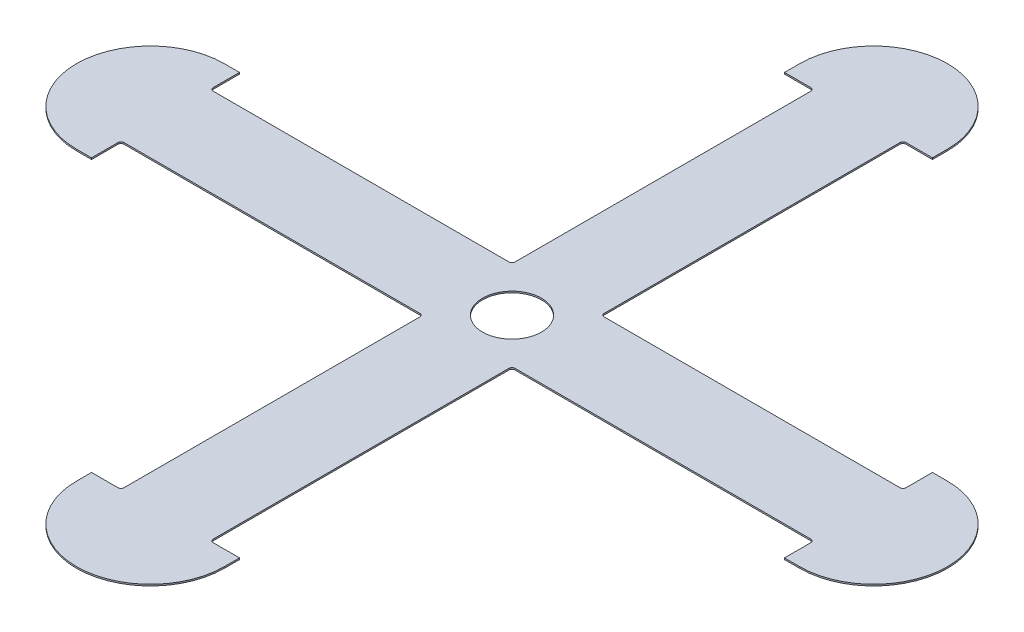
from build123d import *

# Parameters (mm, degrees)
SKETCH1_W           = 22.95
SKETCH1_H           = 22.95
SKETCH1_W_2         = 22.45
SKETCH1_H_2         = 22.45
SKETCH1_W_3         = 0.25
SKETCH1_H_3         = 9.5
SKETCH1_W_4         = 9.5
SKETCH1_H_4         = 0.25
SKETCH1_R           = 0.975
SKETCH1_H_5         = 1
SKETCH1_W_5         = 1
BOSS_EXTRUDE5_DEPTH = 0.05
CUT_EXTRUDE1_DEPTH  = 17.93528122
SKETCH4_W           = 0.75
SKETCH4_H           = 2.95
SKETCH4_W_2         = 9.5
SKETCH4_W_3         = 2.95
SKETCH4_H_2         = 9.5
SKETCH4_H_3         = 0.75
BOSS_EXTRUDE9_DEPTH = 0.05


with BuildPart() as part:
    # Sketch1 → Boss-Extrude5 (new body)
    # profile 1 of 26: a face of its own
    with BuildSketch(Plane(origin=(0, 0, 0), x_dir=(1, 0, 0), z_dir=(0, 1, 0))):
        Rectangle(SKETCH1_W, SKETCH1_H)
        Rectangle(SKETCH1_W_2, SKETCH1_H_2, mode=Mode.SUBTRACT)
    # profile 2 of 26: a face of its own
    with BuildSketch(Plane(origin=(0, 0, 0), x_dir=(1, 0, 0), z_dir=(0, 1, 0))):
        with Locations((-1.6, -6.475)):
            Rectangle(SKETCH1_W_3, SKETCH1_H_3)
    # profile 3 of 26: a face of its own
    with BuildSketch(Plane(origin=(0, 0, 0), x_dir=(1, 0, 0), z_dir=(0, 1, 0))):
        with Locations((-6.475, -1.6)):
            Rectangle(SKETCH1_W_4, SKETCH1_H_4)
    # profile 4 of 26: a face of its own
    with BuildSketch(Plane(origin=(0, 0, 0), x_dir=(1, 0, 0), z_dir=(0, 1, 0))):
        Polygon((-1.475, -1.475), (-1.475, -1.725), (1.475, -1.725), (1.475, -1.475), (1.725, -1.475), (1.725, 1.475), (1.475, 1.475), (1.475, 1.725), (-1.475, 1.725), (-1.475, 1.475), (-1.725, 1.475), (-1.725, -1.475), align=None)
        with Locations(Location((0, 0, 0), (0, 0, 270))):
            Circle(SKETCH1_R, mode=Mode.SUBTRACT)
    # profile 5 of 26: a face of its own
    with BuildSketch(Plane(origin=(0, 0, 0), x_dir=(1, 0, 0), z_dir=(0, 1, 0))):
        with Locations((-1.6, -1.6)):
            Rectangle(SKETCH1_W_3, SKETCH1_H_4)
    # profile 6 of 26: a face of its own
    with BuildSketch(Plane(origin=(0, 0, 0), x_dir=(1, 0, 0), z_dir=(0, 1, 0))):
        with Locations((1.6, -1.6)):
            Rectangle(SKETCH1_W_3, SKETCH1_H_4)
    # profile 7 of 26: a face of its own
    with BuildSketch(Plane(origin=(0, 0, 0), x_dir=(1, 0, 0), z_dir=(0, 1, 0))):
        with Locations((6.475, -1.6)):
            Rectangle(SKETCH1_W_4, SKETCH1_H_4)
    # profile 8 of 26: a face of its own
    with BuildSketch(Plane(origin=(0, 0, 0), x_dir=(1, 0, 0), z_dir=(0, 1, 0))):
        with Locations((1.6, -6.475)):
            Rectangle(SKETCH1_W_3, SKETCH1_H_3)
    # profile 9 of 26: a face of its own
    with BuildSketch(Plane(origin=(0, 0, 0), x_dir=(1, 0, 0), z_dir=(0, 1, 0))):
        with Locations((1.6, 1.6)):
            Rectangle(SKETCH1_W_3, SKETCH1_H_4)
    # profile 10 of 26: a face of its own
    with BuildSketch(Plane(origin=(0, 0, 0), x_dir=(1, 0, 0), z_dir=(0, 1, 0))):
        with Locations((6.475, 1.6)):
            Rectangle(SKETCH1_W_4, SKETCH1_H_4)
    # profile 11 of 26: a face of its own
    with BuildSketch(Plane(origin=(0, 0, 0), x_dir=(1, 0, 0), z_dir=(0, 1, 0))):
        with Locations((1.6, 6.475)):
            Rectangle(SKETCH1_W_3, SKETCH1_H_3)
    # profile 12 of 26: a face of its own
    with BuildSketch(Plane(origin=(0, 0, 0), x_dir=(1, 0, 0), z_dir=(0, 1, 0))):
        with Locations((-1.6, 1.6)):
            Rectangle(SKETCH1_W_3, SKETCH1_H_4)
    # profile 13 of 26: a face of its own
    with BuildSketch(Plane(origin=(0, 0, 0), x_dir=(1, 0, 0), z_dir=(0, 1, 0))):
        with Locations((-6.475, 1.6)):
            Rectangle(SKETCH1_W_4, SKETCH1_H_4)
    # profile 14 of 26: a face of its own
    with BuildSketch(Plane(origin=(0, 0, 0), x_dir=(1, 0, 0), z_dir=(0, 1, 0))):
        with Locations((-1.6, 6.475)):
            Rectangle(SKETCH1_W_3, SKETCH1_H_3)
    # profile 15 of 26: a face of its own
    with BuildSketch(Plane(origin=(0, 0, 0), x_dir=(1, 0, 0), z_dir=(0, 1, 0))):
        with Locations((-11.6, -1.95)):
            Rectangle(SKETCH1_W_3, SKETCH1_H_5)
    # profile 16 of 26: a face of its own
    with BuildSketch(Plane(origin=(0, 0, 0), x_dir=(1, 0, 0), z_dir=(0, 1, 0))):
        with Locations((-11.6, 1.95)):
            Rectangle(SKETCH1_W_3, SKETCH1_H_5)
    # profile 17 of 26: a face of its own
    with BuildSketch(Plane(origin=(0, 0, 0), x_dir=(1, 0, 0), z_dir=(0, 1, 0))):
        with Locations((11.6, -1.95)):
            Rectangle(SKETCH1_W_3, SKETCH1_H_5)
    # profile 18 of 26: a face of its own
    with BuildSketch(Plane(origin=(0, 0, 0), x_dir=(1, 0, 0), z_dir=(0, 1, 0))):
        with Locations((11.6, 1.95)):
            Rectangle(SKETCH1_W_3, SKETCH1_H_5)
    # profile 19 of 26: a face of its own
    with BuildSketch(Plane(origin=(0, 0, 0), x_dir=(1, 0, 0), z_dir=(0, 1, 0))):
        with Locations((1.95, -11.6)):
            Rectangle(SKETCH1_W_5, SKETCH1_H_4)
    # profile 20 of 26: a face of its own
    with BuildSketch(Plane(origin=(0, 0, 0), x_dir=(1, 0, 0), z_dir=(0, 1, 0))):
        with Locations((-1.95, -11.6)):
            Rectangle(SKETCH1_W_5, SKETCH1_H_4)
    # profile 21 of 26: a face of its own
    with BuildSketch(Plane(origin=(0, 0, 0), x_dir=(1, 0, 0), z_dir=(0, 1, 0))):
        with Locations((1.95, 11.6)):
            Rectangle(SKETCH1_W_5, SKETCH1_H_4)
    # profile 22 of 26: a face of its own
    with BuildSketch(Plane(origin=(0, 0, 0), x_dir=(1, 0, 0), z_dir=(0, 1, 0))):
        with Locations((-1.95, 11.6)):
            Rectangle(SKETCH1_W_5, SKETCH1_H_4)
    # profile 23 of 26: a face of its own
    with BuildSketch(Plane(origin=(0, 0, 0), x_dir=(1, 0, 0), z_dir=(0, 1, 0))):
        Polygon((-11.975, -2.45), (-11.725, -2.45), (-11.725, -1.45), (-11.725, 1.45), (-11.725, 2.45), (-11.975, 2.45), align=None)
    # profile 24 of 26: a face of its own
    with BuildSketch(Plane(origin=(0, 0, 0), x_dir=(1, 0, 0), z_dir=(0, 1, 0))):
        Polygon((2.45, -11.975), (2.45, -11.725), (1.45, -11.725), (-1.45, -11.725), (-2.45, -11.725), (-2.45, -11.975), align=None)
    # profile 25 of 26: a face of its own
    with BuildSketch(Plane(origin=(0, 0, 0), x_dir=(1, 0, 0), z_dir=(0, 1, 0))):
        Polygon((11.725, -1.45), (11.725, -2.45), (11.975, -2.45), (11.975, 2.45), (11.725, 2.45), (11.725, 1.45), align=None)
    # profile 26 of 26: a face of its own
    with BuildSketch(Plane(origin=(0, 0, 0), x_dir=(1, 0, 0), z_dir=(0, 1, 0))):
        Polygon((1.45, 11.725), (2.45, 11.725), (2.45, 11.975), (-2.45, 11.975), (-2.45, 11.725), (-1.45, 11.725), align=None)
    extrude(amount=BOSS_EXTRUDE5_DEPTH)

    # Sketch2 → Cut-Extrude1 (cut, through all)
    with BuildSketch(Plane(origin=(0, 0.05, 0), x_dir=(1, 0, 0), z_dir=(0, 1, 0))):
        with BuildLine():
            Line((-11.475, 11.475), (-1.575, 11.475))
            ThreePointArc((-1.575, 11.475), (-1.504289322, 11.445710678), (-1.475, 11.375))
            Line((-1.475, 11.375), (-1.475, 1.575))
            ThreePointArc((-1.475, 1.575), (-1.504289322, 1.504289322), (-1.575, 1.475))
            Line((-1.575, 1.475), (-11.375, 1.475))
            ThreePointArc((-11.375, 1.475), (-11.445710678, 1.504289322), (-11.475, 1.575))
            Line((-11.475, 1.575), (-11.475, 11.475))
        make_face()
        with BuildLine():
            Line((11.475, 11.475), (1.575, 11.475))
            ThreePointArc((1.575, 11.475), (1.504289322, 11.445710678), (1.475, 11.375))
            Line((1.475, 11.375), (1.475, 1.575))
            ThreePointArc((1.475, 1.575), (1.504289322, 1.504289322), (1.575, 1.475))
            Line((1.575, 1.475), (11.375, 1.475))
            ThreePointArc((11.375, 1.475), (11.445710678, 1.504289322), (11.475, 1.575))
            Line((11.475, 1.575), (11.475, 11.475))
        make_face()
        with BuildLine():
            Line((11.475, -11.475), (11.475, -1.575))
            ThreePointArc((11.475, -1.575), (11.445710678, -1.504289322), (11.375, -1.475))
            Line((11.375, -1.475), (1.575, -1.475))
            ThreePointArc((1.575, -1.475), (1.504289322, -1.504289322), (1.475, -1.575))
            Line((1.475, -1.575), (1.475, -11.375))
            ThreePointArc((1.475, -11.375), (1.504289322, -11.445710678), (1.575, -11.475))
            Line((1.575, -11.475), (11.475, -11.475))
        make_face()
        with BuildLine():
            Line((-11.475, -11.475), (-1.575, -11.475))
            ThreePointArc((-1.575, -11.475), (-1.504289322, -11.445710678), (-1.475, -11.375))
            Line((-1.475, -11.375), (-1.475, -1.575))
            ThreePointArc((-1.475, -1.575), (-1.504289322, -1.504289322), (-1.575, -1.475))
            Line((-1.575, -1.475), (-11.375, -1.475))
            ThreePointArc((-11.375, -1.475), (-11.445710678, -1.504289322), (-11.475, -1.575))
            Line((-11.475, -1.575), (-11.475, -11.475))
        make_face()
    extrude(amount=-CUT_EXTRUDE1_DEPTH, mode=Mode.SUBTRACT)


with BuildPart() as cut_extrude1_piece_1:
    # of the separate pieces the step leaves, piece 1, a body of its own (cut_extrude1_pieces)
    add(part.part.solids().sort_by_distance((-1.725, 0, 1.475))[0])



with BuildPart() as cut_extrude1_piece_2:
    # of the separate pieces the step leaves, piece 2, a body of its own (cut_extrude1_pieces)
    add(part.part.solids().sort_by_distance((-1.575, 0, -11.475))[0])


with BuildPart() as cut_extrude1_piece_3:
    # of the separate pieces the step leaves, piece 3, a body of its own (cut_extrude1_pieces)
    add(part.part.solids().sort_by_distance((-11.475, 0, 2.45))[0])


with BuildPart() as cut_extrude1_piece_4:
    # of the separate pieces the step leaves, piece 4, a body of its own (cut_extrude1_pieces)
    add(part.part.solids().sort_by_distance((11.975, 0, 2.45))[0])


with BuildPart() as cut_extrude1_piece_5:
    # of the separate pieces the step leaves, piece 5, a body of its own (cut_extrude1_pieces)
    add(part.part.solids().sort_by_distance((-2.45, 0, 11.975))[0])


with BuildPart() as cut_extrude1_piece_1_1:
    add(cut_extrude1_piece_1.part)

    add(cut_extrude1_piece_2.part)  # Boss-Extrude9 merges Cut-Extrude1 piece 2

    add(cut_extrude1_piece_3.part)  # Boss-Extrude9 merges Cut-Extrude1 piece 3

    add(cut_extrude1_piece_4.part)  # Boss-Extrude9 merges Cut-Extrude1 piece 4

    add(cut_extrude1_piece_5.part)  # Boss-Extrude9 merges Cut-Extrude1 piece 5
    # Sketch4 → Boss-Extrude9 (add)
    with BuildSketch(Plane(origin=(0, 0.05, 0), x_dir=(1, 0, 0), z_dir=(0, 1, 0))):
        with BuildLine():
            Line((-11.975, 2.45), (-11.975, -2.45))
            ThreePointArc((-11.975, -2.45), (-14.425, 0), (-11.975, 2.45))
        make_face()
        with Locations((-11.6, 0)):
            Rectangle(SKETCH4_W, SKETCH4_H)
        with Locations((-6.475, 0)):
            Rectangle(SKETCH4_W_2, SKETCH4_H)
        with Locations((6.475, 0)):
            Rectangle(SKETCH4_W_2, SKETCH4_H)
        with Locations((0, 6.475)):
            Rectangle(SKETCH4_W_3, SKETCH4_H_2)
        with BuildLine():
            Line((11.975, -2.45), (11.975, 2.45))
            ThreePointArc((11.975, 2.45), (14.425, 0), (11.975, -2.45))
        make_face()
        with BuildLine():
            Line((-2.45, -11.975), (2.45, -11.975))
            ThreePointArc((2.45, -11.975), (0, -14.425), (-2.45, -11.975))
        make_face()
        with BuildLine():
            Line((2.45, 11.975), (-2.45, 11.975))
            ThreePointArc((-2.45, 11.975), (0, 14.425), (2.45, 11.975))
        make_face()
        with Locations((0, 11.6)):
            Rectangle(SKETCH4_W_3, SKETCH4_H_3)
        with Locations((11.6, 0)):
            Rectangle(SKETCH4_W, SKETCH4_H)
        with Locations((0, -6.475)):
            Rectangle(SKETCH4_W_3, SKETCH4_H_2)
        with Locations((0, -11.6)):
            Rectangle(SKETCH4_W_3, SKETCH4_H_3)
    extrude(amount=-BOSS_EXTRUDE9_DEPTH)


solid = cut_extrude1_piece_1_1.part
